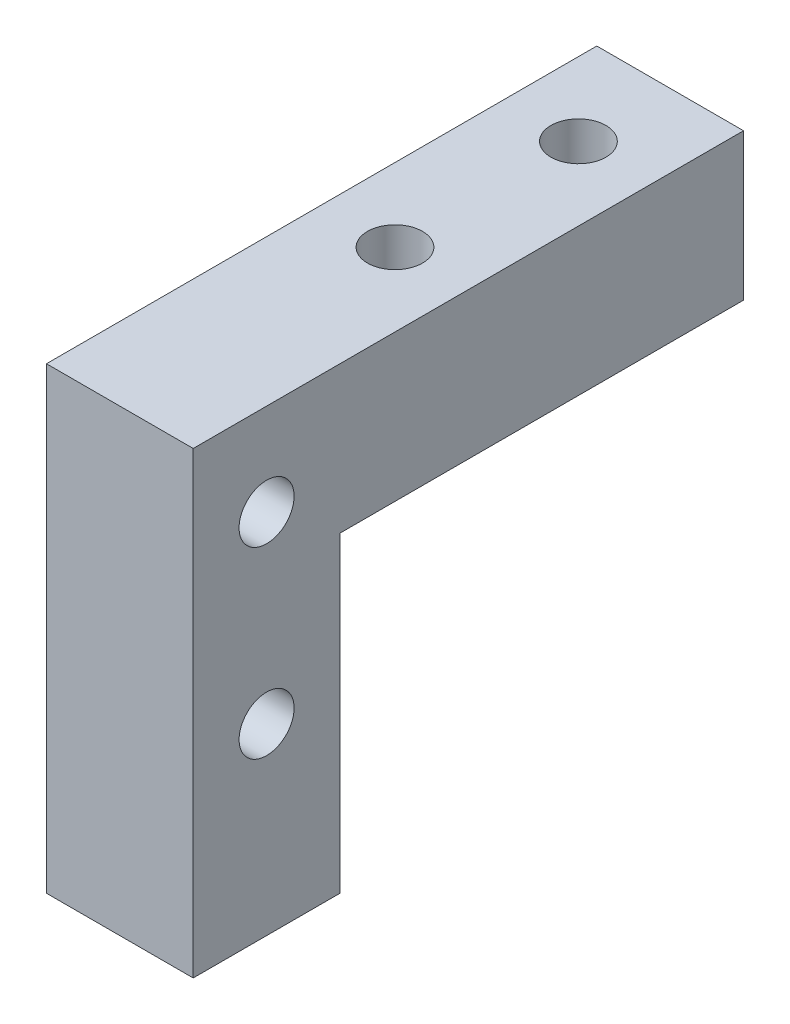
from build123d import *

# Parameters (mm, degrees)
BOSS_EXTRUDE1_DEPTH = 8
SKETCH2_R           = 3
CUT_EXTRUDE1_DEPTH  = 58.861904566
SKETCH3_R           = 3
CUT_EXTRUDE2_DEPTH  = 68.082039325


with BuildPart() as part:
    # Sketch1 → Boss-Extrude1 (new, symmetric)
    with BuildSketch(Plane(origin=(0, 0, 0), x_dir=(0, 0, -1), z_dir=(1, 0, 0))):
        Polygon((0, 0), (0, -34), (-16, -34), (-16, 16), (44, 16), (44, 0), align=None)
    extrude(amount=BOSS_EXTRUDE1_DEPTH, both=True)

    # Sketch2 → Cut-Extrude1 (cut, through all)
    with BuildSketch(Plane(origin=(8, 0, 0), x_dir=(0, 0, -1), z_dir=(1, 0, 0))):
        with Locations((-8, 6)):
            Circle(SKETCH2_R)
        with Locations((-8, -14)):
            Circle(SKETCH2_R)
    extrude(amount=-CUT_EXTRUDE1_DEPTH, mode=Mode.SUBTRACT)

    # Sketch3 → Cut-Extrude2 (cut, through all)
    with BuildSketch(Plane(origin=(0, 16, 0), x_dir=(1, 0, 0), z_dir=(0, 1, 0))):
        with Locations(Location((0, 34, 0), (0, 0, 270))):
            Circle(SKETCH3_R)
        with Locations(Location((0, 14, 0), (0, 0, 270))):
            Circle(SKETCH3_R)
    extrude(amount=-CUT_EXTRUDE2_DEPTH, mode=Mode.SUBTRACT)


solid = part.part
